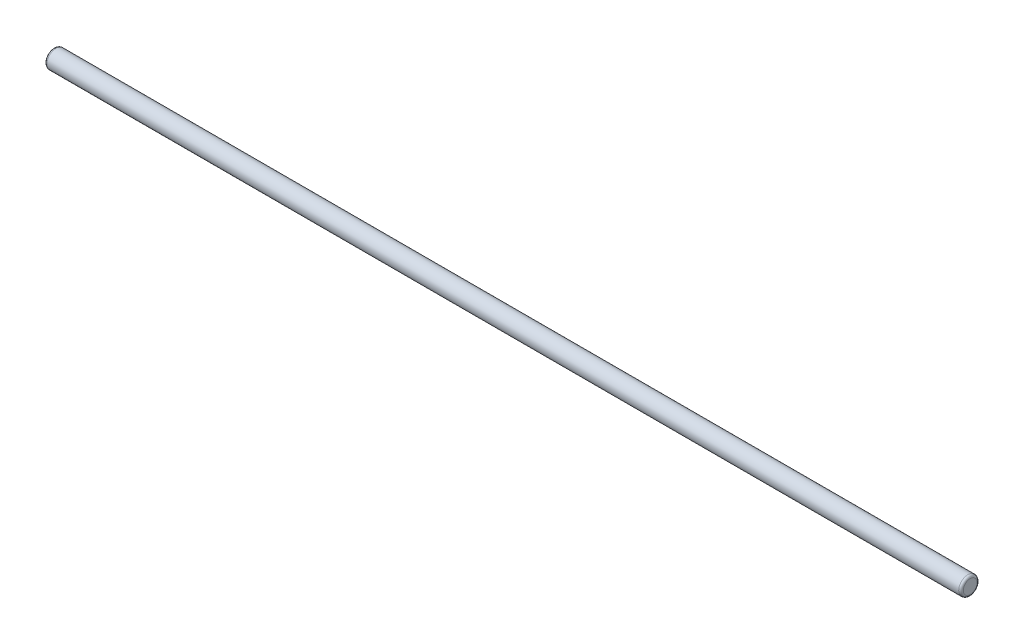
from build123d import *

# Parameters (mm, degrees)
PROFILESKETCH1_R           = 4
PROFILEBOSS_EXTRUDE1_DEPTH = 400
FILLET1_R                  = 1


with BuildPart() as part:
    # ProfileSketch1 → ProfileBoss-Extrude1 (new body)
    with BuildSketch(Plane(origin=(0, 0, 0), x_dir=(0, 0, -1), z_dir=(1, 0, 0))):
        Circle(PROFILESKETCH1_R)
    extrude(amount=PROFILEBOSS_EXTRUDE1_DEPTH)

    # Fillet1
    fillet1_edges = [part.edges().sort_by_distance(p)[0] for p in [
        (0, 0, 4),
        (400, 0, 4),
    ]]
    fillet(fillet1_edges, radius=FILLET1_R)


solid = part.part
